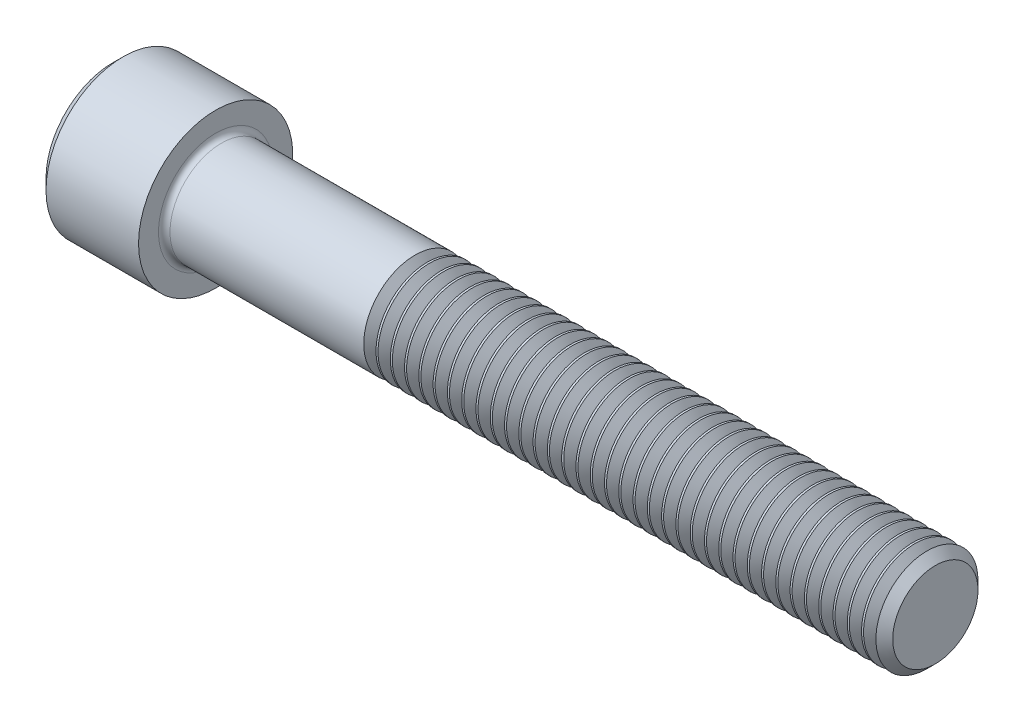
from build123d import *

# Parameters (mm, degrees)
SKETCH1_W             = 6.35
SKETCH1_H             = 4.7625
SKETCH2_R             = 3.175
BOSS_EXTRUDE1_DEPTH   = 12.321173718
SKETCH3_R             = 3.175
BOSS_EXTRUDE2_DEPTH   = 0.378826282
BOSS_EXTRUDE2_TAPER   = 55.000000002
SKETCH4_R             = 2.63398
BOSS_EXTRUDE3_DEPTH   = 0.378826282
BOSS_EXTRUDE3_DRAFT   = -55
SKETCH5_R             = 3.175
BOSS_EXTRUDE4_DEPTH   = 0.12429188
SKETCH6_R             = 3.175
BOSS_EXTRUDE5_DEPTH   = 0.378826282
BOSS_EXTRUDE5_TAPER   = 55.000000002
SKETCH7_R             = 2.63398
BOSS_EXTRUDE6_DEPTH   = 0.378826282
BOSS_EXTRUDE6_DRAFT   = -55
SKETCH8_R             = 3.175
BOSS_EXTRUDE7_DEPTH   = 0.12429188
SKETCH9_R             = 3.175
BOSS_EXTRUDE8_DEPTH   = 0.378826282
BOSS_EXTRUDE8_TAPER   = 55.000000002
SKETCH10_R            = 2.63398
BOSS_EXTRUDE9_DEPTH   = 0.378826282
BOSS_EXTRUDE9_DRAFT   = -55
SKETCH11_R            = 3.175
BOSS_EXTRUDE10_DEPTH  = 0.12429188
SKETCH12_R            = 3.175
BOSS_EXTRUDE11_DEPTH  = 0.378826282
BOSS_EXTRUDE11_TAPER  = 55.000000002
SKETCH13_R            = 2.63398
BOSS_EXTRUDE12_DEPTH  = 0.378826282
BOSS_EXTRUDE12_DRAFT  = -55
SKETCH14_R            = 3.175
BOSS_EXTRUDE13_DEPTH  = 0.12429188
SKETCH15_R            = 3.175
BOSS_EXTRUDE14_DEPTH  = 0.378826282
BOSS_EXTRUDE14_TAPER  = 55.000000002
SKETCH16_R            = 2.63398
BOSS_EXTRUDE15_DEPTH  = 0.378826282
BOSS_EXTRUDE15_DRAFT  = -55
SKETCH17_R            = 3.175
BOSS_EXTRUDE16_DEPTH  = 0.12429188
SKETCH18_R            = 3.175
BOSS_EXTRUDE17_DEPTH  = 0.378826282
BOSS_EXTRUDE17_TAPER  = 55.000000002
SKETCH19_R            = 2.63398
BOSS_EXTRUDE18_DEPTH  = 0.378826282
BOSS_EXTRUDE18_DRAFT  = -55
SKETCH20_R            = 3.175
BOSS_EXTRUDE19_DEPTH  = 0.12429188
SKETCH21_R            = 3.175
BOSS_EXTRUDE20_DEPTH  = 0.378826282
BOSS_EXTRUDE20_TAPER  = 55.000000002
SKETCH22_R            = 2.63398
BOSS_EXTRUDE21_DEPTH  = 0.378826282
BOSS_EXTRUDE21_DRAFT  = -55
SKETCH23_R            = 3.175
BOSS_EXTRUDE22_DEPTH  = 0.12429188
SKETCH24_R            = 3.175
BOSS_EXTRUDE23_DEPTH  = 0.378826282
BOSS_EXTRUDE23_TAPER  = 55.000000002
SKETCH25_R            = 2.63398
BOSS_EXTRUDE24_DEPTH  = 0.378826282
BOSS_EXTRUDE24_DRAFT  = -55
SKETCH26_R            = 3.175
BOSS_EXTRUDE25_DEPTH  = 0.12429188
SKETCH27_R            = 3.175
BOSS_EXTRUDE26_DEPTH  = 0.378826282
BOSS_EXTRUDE26_TAPER  = 55.000000002
SKETCH28_R            = 2.63398
BOSS_EXTRUDE27_DEPTH  = 0.378826282
BOSS_EXTRUDE27_DRAFT  = -55
SKETCH29_R            = 3.175
BOSS_EXTRUDE28_DEPTH  = 0.12429188
SKETCH30_R            = 3.175
BOSS_EXTRUDE29_DEPTH  = 0.378826282
BOSS_EXTRUDE29_TAPER  = 55.000000002
SKETCH31_R            = 2.63398
BOSS_EXTRUDE30_DEPTH  = 0.378826282
BOSS_EXTRUDE30_DRAFT  = -55
SKETCH32_R            = 3.175
BOSS_EXTRUDE31_DEPTH  = 0.12429188
SKETCH33_R            = 3.175
BOSS_EXTRUDE32_DEPTH  = 0.378826282
BOSS_EXTRUDE32_TAPER  = 55.000000002
SKETCH34_R            = 2.63398
BOSS_EXTRUDE33_DEPTH  = 0.378826282
BOSS_EXTRUDE33_DRAFT  = -55
SKETCH35_R            = 3.175
BOSS_EXTRUDE34_DEPTH  = 0.12429188
SKETCH36_R            = 3.175
BOSS_EXTRUDE35_DEPTH  = 0.378826282
BOSS_EXTRUDE35_TAPER  = 55.000000002
SKETCH37_R            = 2.63398
BOSS_EXTRUDE36_DEPTH  = 0.378826282
BOSS_EXTRUDE36_DRAFT  = -55
SKETCH38_R            = 3.175
BOSS_EXTRUDE37_DEPTH  = 0.12429188
SKETCH39_R            = 3.175
BOSS_EXTRUDE38_DEPTH  = 0.378826282
BOSS_EXTRUDE38_TAPER  = 55.000000002
SKETCH40_R            = 2.63398
BOSS_EXTRUDE39_DEPTH  = 0.378826282
BOSS_EXTRUDE39_DRAFT  = -55
SKETCH41_R            = 3.175
BOSS_EXTRUDE40_DEPTH  = 0.12429188
SKETCH42_R            = 3.175
BOSS_EXTRUDE41_DEPTH  = 0.378826282
BOSS_EXTRUDE41_TAPER  = 55.000000002
SKETCH43_R            = 2.63398
BOSS_EXTRUDE42_DEPTH  = 0.378826282
BOSS_EXTRUDE42_DRAFT  = -55
SKETCH44_R            = 3.175
BOSS_EXTRUDE43_DEPTH  = 0.12429188
SKETCH45_R            = 3.175
BOSS_EXTRUDE44_DEPTH  = 0.378826282
BOSS_EXTRUDE44_TAPER  = 54.999999999
SKETCH46_R            = 2.63398
BOSS_EXTRUDE45_DEPTH  = 0.378826282
BOSS_EXTRUDE45_DRAFT  = -55
SKETCH47_R            = 3.175
BOSS_EXTRUDE46_DEPTH  = 0.12429188
SKETCH48_R            = 3.175
BOSS_EXTRUDE47_DEPTH  = 0.378826282
BOSS_EXTRUDE47_TAPER  = 54.999999999
SKETCH49_R            = 2.63398
BOSS_EXTRUDE48_DEPTH  = 0.378826282
BOSS_EXTRUDE48_DRAFT  = -55
SKETCH50_R            = 3.175
BOSS_EXTRUDE49_DEPTH  = 0.12429188
SKETCH51_R            = 3.175
BOSS_EXTRUDE50_DEPTH  = 0.378826282
BOSS_EXTRUDE50_TAPER  = 54.999999999
SKETCH52_R            = 2.63398
BOSS_EXTRUDE51_DEPTH  = 0.378826282
BOSS_EXTRUDE51_DRAFT  = -55
SKETCH53_R            = 3.175
BOSS_EXTRUDE52_DEPTH  = 0.12429188
SKETCH54_R            = 3.175
BOSS_EXTRUDE53_DEPTH  = 0.378826282
BOSS_EXTRUDE53_TAPER  = 54.999999999
SKETCH55_R            = 2.63398
BOSS_EXTRUDE54_DEPTH  = 0.378826282
BOSS_EXTRUDE54_DRAFT  = -55
SKETCH56_R            = 3.175
BOSS_EXTRUDE55_DEPTH  = 0.12429188
SKETCH57_R            = 3.175
BOSS_EXTRUDE56_DEPTH  = 0.378826282
BOSS_EXTRUDE56_TAPER  = 54.999999999
SKETCH58_R            = 2.63398
BOSS_EXTRUDE57_DEPTH  = 0.378826282
BOSS_EXTRUDE57_DRAFT  = -55
SKETCH59_R            = 3.175
BOSS_EXTRUDE58_DEPTH  = 0.12429188
SKETCH60_R            = 3.175
BOSS_EXTRUDE59_DEPTH  = 0.378826282
BOSS_EXTRUDE59_TAPER  = 54.999999999
SKETCH61_R            = 2.63398
BOSS_EXTRUDE60_DEPTH  = 0.378826282
BOSS_EXTRUDE60_DRAFT  = -55
SKETCH62_R            = 3.175
BOSS_EXTRUDE61_DEPTH  = 0.12429188
SKETCH63_R            = 3.175
BOSS_EXTRUDE62_DEPTH  = 0.378826282
BOSS_EXTRUDE62_TAPER  = 54.999999999
SKETCH64_R            = 2.63398
BOSS_EXTRUDE63_DEPTH  = 0.378826282
BOSS_EXTRUDE63_DRAFT  = -55
SKETCH65_R            = 3.175
BOSS_EXTRUDE64_DEPTH  = 0.12429188
SKETCH66_R            = 3.175
BOSS_EXTRUDE65_DEPTH  = 0.378826282
BOSS_EXTRUDE65_TAPER  = 54.999999999
SKETCH67_R            = 2.63398
BOSS_EXTRUDE66_DEPTH  = 0.378826282
BOSS_EXTRUDE66_DRAFT  = -55
SKETCH68_R            = 3.175
BOSS_EXTRUDE67_DEPTH  = 0.12429188
SKETCH69_R            = 3.175
BOSS_EXTRUDE68_DEPTH  = 0.378826282
BOSS_EXTRUDE68_TAPER  = 54.999999999
SKETCH70_R            = 2.63398
BOSS_EXTRUDE69_DEPTH  = 0.378826282
BOSS_EXTRUDE69_DRAFT  = -55
SKETCH71_R            = 3.175
BOSS_EXTRUDE70_DEPTH  = 0.12429188
SKETCH72_R            = 3.175
BOSS_EXTRUDE71_DEPTH  = 0.378826282
BOSS_EXTRUDE71_TAPER  = 54.999999999
SKETCH73_R            = 2.63398
BOSS_EXTRUDE72_DEPTH  = 0.378826282
BOSS_EXTRUDE72_DRAFT  = -55
SKETCH74_R            = 3.175
BOSS_EXTRUDE73_DEPTH  = 0.12429188
SKETCH75_R            = 3.175
BOSS_EXTRUDE74_DEPTH  = 0.378826282
BOSS_EXTRUDE74_TAPER  = 54.999999999
SKETCH76_R            = 2.63398
BOSS_EXTRUDE75_DEPTH  = 0.378826282
BOSS_EXTRUDE75_DRAFT  = -55
SKETCH77_R            = 3.175
BOSS_EXTRUDE76_DEPTH  = 0.12429188
SKETCH78_R            = 3.175
BOSS_EXTRUDE77_DEPTH  = 0.378826282
BOSS_EXTRUDE77_TAPER  = 54.999999999
SKETCH79_R            = 2.63398
BOSS_EXTRUDE78_DEPTH  = 0.378826282
BOSS_EXTRUDE78_DRAFT  = -55
SKETCH80_R            = 3.175
BOSS_EXTRUDE79_DEPTH  = 0.12429188
SKETCH81_R            = 3.175
BOSS_EXTRUDE80_DEPTH  = 0.378826282
BOSS_EXTRUDE80_TAPER  = 54.999999999
SKETCH82_R            = 2.63398
BOSS_EXTRUDE81_DEPTH  = 0.378826282
BOSS_EXTRUDE81_DRAFT  = -55
SKETCH83_R            = 3.175
BOSS_EXTRUDE82_DEPTH  = 0.12429188
SKETCH84_R            = 3.175
BOSS_EXTRUDE83_DEPTH  = 0.378826282
BOSS_EXTRUDE83_TAPER  = 54.999999999
SKETCH85_R            = 2.63398
BOSS_EXTRUDE84_DEPTH  = 0.378826282
BOSS_EXTRUDE84_DRAFT  = -55
SKETCH86_R            = 3.175
BOSS_EXTRUDE85_DEPTH  = 0.12429188
SKETCH87_R            = 3.175
BOSS_EXTRUDE86_DEPTH  = 0.378826282
BOSS_EXTRUDE86_TAPER  = 54.999999999
SKETCH88_R            = 2.63398
BOSS_EXTRUDE87_DEPTH  = 0.378826282
BOSS_EXTRUDE87_DRAFT  = -55
SKETCH89_R            = 3.175
BOSS_EXTRUDE88_DEPTH  = 0.12429188
SKETCH90_R            = 3.175
BOSS_EXTRUDE89_DEPTH  = 0.378826282
BOSS_EXTRUDE89_TAPER  = 54.999999999
SKETCH91_R            = 2.63398
BOSS_EXTRUDE90_DEPTH  = 0.378826282
BOSS_EXTRUDE90_DRAFT  = -55
SKETCH92_R            = 3.175
BOSS_EXTRUDE91_DEPTH  = 0.12429188
SKETCH93_R            = 3.175
BOSS_EXTRUDE92_DEPTH  = 0.378826282
BOSS_EXTRUDE92_TAPER  = 54.999999999
SKETCH94_R            = 2.63398
BOSS_EXTRUDE93_DEPTH  = 0.378826282
BOSS_EXTRUDE93_DRAFT  = -55
SKETCH95_R            = 3.175
BOSS_EXTRUDE94_DEPTH  = 0.12429188
SKETCH96_R            = 3.175
BOSS_EXTRUDE95_DEPTH  = 0.378826282
BOSS_EXTRUDE95_TAPER  = 54.999999999
SKETCH97_R            = 2.63398
BOSS_EXTRUDE96_DEPTH  = 0.378826282
BOSS_EXTRUDE96_DRAFT  = -55
SKETCH98_R            = 3.175
BOSS_EXTRUDE97_DEPTH  = 0.12429188
SKETCH99_R            = 3.175
BOSS_EXTRUDE98_DEPTH  = 0.378826282
BOSS_EXTRUDE98_TAPER  = 54.999999999
SKETCH100_R           = 2.63398
BOSS_EXTRUDE99_DEPTH  = 0.378826282
BOSS_EXTRUDE99_DRAFT  = -55
SKETCH101_R           = 3.175
BOSS_EXTRUDE100_DEPTH = 0.12429188
SKETCH102_R           = 3.175
BOSS_EXTRUDE101_DEPTH = 0.378826282
BOSS_EXTRUDE101_TAPER = 54.999999999
SKETCH103_R           = 2.63398
BOSS_EXTRUDE102_DEPTH = 0.378826282
BOSS_EXTRUDE102_DRAFT = -55
SKETCH104_R           = 3.175
BOSS_EXTRUDE103_DEPTH = 0.12429188
SKETCH105_R           = 3.175
BOSS_EXTRUDE104_DEPTH = 0.378826282
BOSS_EXTRUDE104_TAPER = 54.999999999
SKETCH106_R           = 2.63398
BOSS_EXTRUDE105_DEPTH = 0.378826282
BOSS_EXTRUDE105_DRAFT = -55
SKETCH107_R           = 3.175
BOSS_EXTRUDE106_DEPTH = 0.12429188
SKETCH108_R           = 3.175
BOSS_EXTRUDE107_DEPTH = 0.378826282
BOSS_EXTRUDE107_TAPER = 54.999999999
SKETCH109_R           = 2.63398
BOSS_EXTRUDE108_DEPTH = 0.363216922
BOSS_EXTRUDE108_DRAFT = -54.999999998
SKETCH110_R           = 3.152707523
BOSS_EXTRUDE109_DEPTH = 0.518727523
BOSS_EXTRUDE109_TAPER = 45
CUT_EXTRUDE1_DEPTH    = 3.048
CHAMFER1_SIZE         = 0.635
FILLET1_R             = 0.3556


with BuildPart() as part:
    # Sketch1 → Revolve1 (revolve)
    with BuildSketch(Plane(origin=(0, 0, 0), x_dir=(-1, 0, 0), z_dir=(0, 0, -1)), mode=Mode.PRIVATE) as revolve1_sk:
        with Locations((-3.175, 2.38125)):
            Rectangle(SKETCH1_W, SKETCH1_H)
    revolve(revolve1_sk.sketch.rotate(Axis((6.35, 0, 0), (-1, 0, 0)), 270), axis=Axis((6.35, 0, 0), (-1, 0, 0)))

    # Sketch2 → Boss-Extrude1 (add)
    with BuildSketch(Plane(origin=(6.35, 0, 0), x_dir=(0, 0, -1), z_dir=(1, 0, 0))):
        Circle(SKETCH2_R)
    extrude(amount=BOSS_EXTRUDE1_DEPTH)

    # Sketch3 → Boss-Extrude2 (add)
    with BuildSketch(Plane(origin=(18.671173718, 0, 0), x_dir=(0, 0, -1), z_dir=(1, 0, 0))):
        Circle(SKETCH3_R)
    extrude(amount=BOSS_EXTRUDE2_DEPTH, taper=BOSS_EXTRUDE2_TAPER)


with BuildPart() as boss_extrude3_tool:
    # Sketch4 → Boss-Extrude3 (with draft: the straight prism first)
    with BuildSketch(Plane(origin=(19.05, 0, 0), x_dir=(0, 0, -1), z_dir=(1, 0, 0))):
        Circle(SKETCH4_R)
    extrude(amount=BOSS_EXTRUDE3_DEPTH)
    # Boss-Extrude3: the draft: its side faces are tilted about the plane it starts from
    boss_extrude3_sides = [boss_extrude3_tool.faces().sort_by_distance(p)[0] for p in [
        (19.239413141, 0, 2.63398),
    ]]
    draft(boss_extrude3_sides, Plane(origin=(19.05, 0, 0), x_dir=(0, 0, -1), z_dir=(1, 0, 0)), BOSS_EXTRUDE3_DRAFT)


with BuildPart() as part_1:
    add(part.part)

    # Boss-Extrude3: add boss_extrude3_tool
    add(boss_extrude3_tool.part)

    # Sketch5 → Boss-Extrude4 (add)
    with BuildSketch(Plane(origin=(19.428826282, 0, 0), x_dir=(0, 0, -1), z_dir=(1, 0, 0))):
        Circle(SKETCH5_R)
    extrude(amount=BOSS_EXTRUDE4_DEPTH)

    # Sketch6 → Boss-Extrude5 (add)
    with BuildSketch(Plane(origin=(19.553118162, 0, 0), x_dir=(0, 0, -1), z_dir=(1, 0, 0))):
        Circle(SKETCH6_R)
    extrude(amount=BOSS_EXTRUDE5_DEPTH, taper=BOSS_EXTRUDE5_TAPER)


with BuildPart() as boss_extrude6_tool:
    # Sketch7 → Boss-Extrude6 (with draft: the straight prism first)
    with BuildSketch(Plane(origin=(19.931944444, 0, 0), x_dir=(0, 0, -1), z_dir=(1, 0, 0))):
        Circle(SKETCH7_R)
    extrude(amount=BOSS_EXTRUDE6_DEPTH)
    # Boss-Extrude6: the draft: its side faces are tilted about the plane it starts from
    boss_extrude6_sides = [boss_extrude6_tool.faces().sort_by_distance(p)[0] for p in [
        (20.121357586, 0, 2.63398),
    ]]
    draft(boss_extrude6_sides, Plane(origin=(19.931944444, 0, 0), x_dir=(0, 0, -1), z_dir=(1, 0, 0)), BOSS_EXTRUDE6_DRAFT)


with BuildPart() as part_2:
    add(part_1.part)

    # Boss-Extrude6: add boss_extrude6_tool
    add(boss_extrude6_tool.part)

    # Sketch8 → Boss-Extrude7 (add)
    with BuildSketch(Plane(origin=(20.310770727, 0, 0), x_dir=(0, 0, -1), z_dir=(1, 0, 0))):
        Circle(SKETCH8_R)
    extrude(amount=BOSS_EXTRUDE7_DEPTH)

    # Sketch9 → Boss-Extrude8 (add)
    with BuildSketch(Plane(origin=(20.435062607, 0, 0), x_dir=(0, 0, -1), z_dir=(1, 0, 0))):
        Circle(SKETCH9_R)
    extrude(amount=BOSS_EXTRUDE8_DEPTH, taper=BOSS_EXTRUDE8_TAPER)


with BuildPart() as boss_extrude9_tool:
    # Sketch10 → Boss-Extrude9 (with draft: the straight prism first)
    with BuildSketch(Plane(origin=(20.813888889, 0, 0), x_dir=(0, 0, -1), z_dir=(1, 0, 0))):
        Circle(SKETCH10_R)
    extrude(amount=BOSS_EXTRUDE9_DEPTH)
    # Boss-Extrude9: the draft: its side faces are tilted about the plane it starts from
    boss_extrude9_sides = [boss_extrude9_tool.faces().sort_by_distance(p)[0] for p in [
        (21.00330203, 0, 2.63398),
    ]]
    draft(boss_extrude9_sides, Plane(origin=(20.813888889, 0, 0), x_dir=(0, 0, -1), z_dir=(1, 0, 0)), BOSS_EXTRUDE9_DRAFT)


with BuildPart() as part_3:
    add(part_2.part)

    # Boss-Extrude9: add boss_extrude9_tool
    add(boss_extrude9_tool.part)

    # Sketch11 → Boss-Extrude10 (add)
    with BuildSketch(Plane(origin=(21.192715171, 0, 0), x_dir=(0, 0, -1), z_dir=(1, 0, 0))):
        Circle(SKETCH11_R)
    extrude(amount=BOSS_EXTRUDE10_DEPTH)

    # Sketch12 → Boss-Extrude11 (add)
    with BuildSketch(Plane(origin=(21.317007051, 0, 0), x_dir=(0, 0, -1), z_dir=(1, 0, 0))):
        Circle(SKETCH12_R)
    extrude(amount=BOSS_EXTRUDE11_DEPTH, taper=BOSS_EXTRUDE11_TAPER)


with BuildPart() as boss_extrude12_tool:
    # Sketch13 → Boss-Extrude12 (with draft: the straight prism first)
    with BuildSketch(Plane(origin=(21.695833333, 0, 0), x_dir=(0, 0, -1), z_dir=(1, 0, 0))):
        Circle(SKETCH13_R)
    extrude(amount=BOSS_EXTRUDE12_DEPTH)
    # Boss-Extrude12: the draft: its side faces are tilted about the plane it starts from
    boss_extrude12_sides = [boss_extrude12_tool.faces().sort_by_distance(p)[0] for p in [
        (21.885246475, 0, 2.63398),
    ]]
    draft(boss_extrude12_sides, Plane(origin=(21.695833333, 0, 0), x_dir=(0, 0, -1), z_dir=(1, 0, 0)), BOSS_EXTRUDE12_DRAFT)


with BuildPart() as part_4:
    add(part_3.part)

    # Boss-Extrude12: add boss_extrude12_tool
    add(boss_extrude12_tool.part)

    # Sketch14 → Boss-Extrude13 (add)
    with BuildSketch(Plane(origin=(22.074659616, 0, 0), x_dir=(0, 0, -1), z_dir=(1, 0, 0))):
        Circle(SKETCH14_R)
    extrude(amount=BOSS_EXTRUDE13_DEPTH)

    # Sketch15 → Boss-Extrude14 (add)
    with BuildSketch(Plane(origin=(22.198951495, 0, 0), x_dir=(0, 0, -1), z_dir=(1, 0, 0))):
        Circle(SKETCH15_R)
    extrude(amount=BOSS_EXTRUDE14_DEPTH, taper=BOSS_EXTRUDE14_TAPER)


with BuildPart() as boss_extrude15_tool:
    # Sketch16 → Boss-Extrude15 (with draft: the straight prism first)
    with BuildSketch(Plane(origin=(22.577777778, 0, 0), x_dir=(0, 0, -1), z_dir=(1, 0, 0))):
        Circle(SKETCH16_R)
    extrude(amount=BOSS_EXTRUDE15_DEPTH)
    # Boss-Extrude15: the draft: its side faces are tilted about the plane it starts from
    boss_extrude15_sides = [boss_extrude15_tool.faces().sort_by_distance(p)[0] for p in [
        (22.767190919, 0, 2.63398),
    ]]
    draft(boss_extrude15_sides, Plane(origin=(22.577777778, 0, 0), x_dir=(0, 0, -1), z_dir=(1, 0, 0)), BOSS_EXTRUDE15_DRAFT)


with BuildPart() as part_5:
    add(part_4.part)

    # Boss-Extrude15: add boss_extrude15_tool
    add(boss_extrude15_tool.part)

    # Sketch17 → Boss-Extrude16 (add)
    with BuildSketch(Plane(origin=(22.95660406, 0, 0), x_dir=(0, 0, -1), z_dir=(1, 0, 0))):
        Circle(SKETCH17_R)
    extrude(amount=BOSS_EXTRUDE16_DEPTH)

    # Sketch18 → Boss-Extrude17 (add)
    with BuildSketch(Plane(origin=(23.08089594, 0, 0), x_dir=(0, 0, -1), z_dir=(1, 0, 0))):
        Circle(SKETCH18_R)
    extrude(amount=BOSS_EXTRUDE17_DEPTH, taper=BOSS_EXTRUDE17_TAPER)


with BuildPart() as boss_extrude18_tool:
    # Sketch19 → Boss-Extrude18 (with draft: the straight prism first)
    with BuildSketch(Plane(origin=(23.459722222, 0, 0), x_dir=(0, 0, -1), z_dir=(1, 0, 0))):
        Circle(SKETCH19_R)
    extrude(amount=BOSS_EXTRUDE18_DEPTH)
    # Boss-Extrude18: the draft: its side faces are tilted about the plane it starts from
    boss_extrude18_sides = [boss_extrude18_tool.faces().sort_by_distance(p)[0] for p in [
        (23.649135363, 0, 2.63398),
    ]]
    draft(boss_extrude18_sides, Plane(origin=(23.459722222, 0, 0), x_dir=(0, 0, -1), z_dir=(1, 0, 0)), BOSS_EXTRUDE18_DRAFT)


with BuildPart() as part_6:
    add(part_5.part)

    # Boss-Extrude18: add boss_extrude18_tool
    add(boss_extrude18_tool.part)

    # Sketch20 → Boss-Extrude19 (add)
    with BuildSketch(Plane(origin=(23.838548505, 0, 0), x_dir=(0, 0, -1), z_dir=(1, 0, 0))):
        Circle(SKETCH20_R)
    extrude(amount=BOSS_EXTRUDE19_DEPTH)

    # Sketch21 → Boss-Extrude20 (add)
    with BuildSketch(Plane(origin=(23.962840384, 0, 0), x_dir=(0, 0, -1), z_dir=(1, 0, 0))):
        Circle(SKETCH21_R)
    extrude(amount=BOSS_EXTRUDE20_DEPTH, taper=BOSS_EXTRUDE20_TAPER)


with BuildPart() as boss_extrude21_tool:
    # Sketch22 → Boss-Extrude21 (with draft: the straight prism first)
    with BuildSketch(Plane(origin=(24.341666667, 0, 0), x_dir=(0, 0, -1), z_dir=(1, 0, 0))):
        Circle(SKETCH22_R)
    extrude(amount=BOSS_EXTRUDE21_DEPTH)
    # Boss-Extrude21: the draft: its side faces are tilted about the plane it starts from
    boss_extrude21_sides = [boss_extrude21_tool.faces().sort_by_distance(p)[0] for p in [
        (24.531079808, 0, 2.63398),
    ]]
    draft(boss_extrude21_sides, Plane(origin=(24.341666667, 0, 0), x_dir=(0, 0, -1), z_dir=(1, 0, 0)), BOSS_EXTRUDE21_DRAFT)


with BuildPart() as part_7:
    add(part_6.part)

    # Boss-Extrude21: add boss_extrude21_tool
    add(boss_extrude21_tool.part)

    # Sketch23 → Boss-Extrude22 (add)
    with BuildSketch(Plane(origin=(24.720492949, 0, 0), x_dir=(0, 0, -1), z_dir=(1, 0, 0))):
        Circle(SKETCH23_R)
    extrude(amount=BOSS_EXTRUDE22_DEPTH)

    # Sketch24 → Boss-Extrude23 (add)
    with BuildSketch(Plane(origin=(24.844784829, 0, 0), x_dir=(0, 0, -1), z_dir=(1, 0, 0))):
        Circle(SKETCH24_R)
    extrude(amount=BOSS_EXTRUDE23_DEPTH, taper=BOSS_EXTRUDE23_TAPER)


with BuildPart() as boss_extrude24_tool:
    # Sketch25 → Boss-Extrude24 (with draft: the straight prism first)
    with BuildSketch(Plane(origin=(25.223611111, 0, 0), x_dir=(0, 0, -1), z_dir=(1, 0, 0))):
        Circle(SKETCH25_R)
    extrude(amount=BOSS_EXTRUDE24_DEPTH)
    # Boss-Extrude24: the draft: its side faces are tilted about the plane it starts from
    boss_extrude24_sides = [boss_extrude24_tool.faces().sort_by_distance(p)[0] for p in [
        (25.413024252, 0, 2.63398),
    ]]
    draft(boss_extrude24_sides, Plane(origin=(25.223611111, 0, 0), x_dir=(0, 0, -1), z_dir=(1, 0, 0)), BOSS_EXTRUDE24_DRAFT)


with BuildPart() as part_8:
    add(part_7.part)

    # Boss-Extrude24: add boss_extrude24_tool
    add(boss_extrude24_tool.part)

    # Sketch26 → Boss-Extrude25 (add)
    with BuildSketch(Plane(origin=(25.602437394, 0, 0), x_dir=(0, 0, -1), z_dir=(1, 0, 0))):
        Circle(SKETCH26_R)
    extrude(amount=BOSS_EXTRUDE25_DEPTH)

    # Sketch27 → Boss-Extrude26 (add)
    with BuildSketch(Plane(origin=(25.726729273, 0, 0), x_dir=(0, 0, -1), z_dir=(1, 0, 0))):
        Circle(SKETCH27_R)
    extrude(amount=BOSS_EXTRUDE26_DEPTH, taper=BOSS_EXTRUDE26_TAPER)


with BuildPart() as boss_extrude27_tool:
    # Sketch28 → Boss-Extrude27 (with draft: the straight prism first)
    with BuildSketch(Plane(origin=(26.105555556, 0, 0), x_dir=(0, 0, -1), z_dir=(1, 0, 0))):
        Circle(SKETCH28_R)
    extrude(amount=BOSS_EXTRUDE27_DEPTH)
    # Boss-Extrude27: the draft: its side faces are tilted about the plane it starts from
    boss_extrude27_sides = [boss_extrude27_tool.faces().sort_by_distance(p)[0] for p in [
        (26.294968697, 0, 2.63398),
    ]]
    draft(boss_extrude27_sides, Plane(origin=(26.105555556, 0, 0), x_dir=(0, 0, -1), z_dir=(1, 0, 0)), BOSS_EXTRUDE27_DRAFT)


with BuildPart() as part_9:
    add(part_8.part)

    # Boss-Extrude27: add boss_extrude27_tool
    add(boss_extrude27_tool.part)

    # Sketch29 → Boss-Extrude28 (add)
    with BuildSketch(Plane(origin=(26.484381838, 0, 0), x_dir=(0, 0, -1), z_dir=(1, 0, 0))):
        Circle(SKETCH29_R)
    extrude(amount=BOSS_EXTRUDE28_DEPTH)

    # Sketch30 → Boss-Extrude29 (add)
    with BuildSketch(Plane(origin=(26.608673718, 0, 0), x_dir=(0, 0, -1), z_dir=(1, 0, 0))):
        Circle(SKETCH30_R)
    extrude(amount=BOSS_EXTRUDE29_DEPTH, taper=BOSS_EXTRUDE29_TAPER)


with BuildPart() as boss_extrude30_tool:
    # Sketch31 → Boss-Extrude30 (with draft: the straight prism first)
    with BuildSketch(Plane(origin=(26.9875, 0, 0), x_dir=(0, 0, -1), z_dir=(1, 0, 0))):
        Circle(SKETCH31_R)
    extrude(amount=BOSS_EXTRUDE30_DEPTH)
    # Boss-Extrude30: the draft: its side faces are tilted about the plane it starts from
    boss_extrude30_sides = [boss_extrude30_tool.faces().sort_by_distance(p)[0] for p in [
        (27.176913141, 0, 2.63398),
    ]]
    draft(boss_extrude30_sides, Plane(origin=(26.9875, 0, 0), x_dir=(0, 0, -1), z_dir=(1, 0, 0)), BOSS_EXTRUDE30_DRAFT)


with BuildPart() as part_10:
    add(part_9.part)

    # Boss-Extrude30: add boss_extrude30_tool
    add(boss_extrude30_tool.part)

    # Sketch32 → Boss-Extrude31 (add)
    with BuildSketch(Plane(origin=(27.366326282, 0, 0), x_dir=(0, 0, -1), z_dir=(1, 0, 0))):
        Circle(SKETCH32_R)
    extrude(amount=BOSS_EXTRUDE31_DEPTH)

    # Sketch33 → Boss-Extrude32 (add)
    with BuildSketch(Plane(origin=(27.490618162, 0, 0), x_dir=(0, 0, -1), z_dir=(1, 0, 0))):
        Circle(SKETCH33_R)
    extrude(amount=BOSS_EXTRUDE32_DEPTH, taper=BOSS_EXTRUDE32_TAPER)


with BuildPart() as boss_extrude33_tool:
    # Sketch34 → Boss-Extrude33 (with draft: the straight prism first)
    with BuildSketch(Plane(origin=(27.869444444, 0, 0), x_dir=(0, 0, -1), z_dir=(1, 0, 0))):
        Circle(SKETCH34_R)
    extrude(amount=BOSS_EXTRUDE33_DEPTH)
    # Boss-Extrude33: the draft: its side faces are tilted about the plane it starts from
    boss_extrude33_sides = [boss_extrude33_tool.faces().sort_by_distance(p)[0] for p in [
        (28.058857586, 0, 2.63398),
    ]]
    draft(boss_extrude33_sides, Plane(origin=(27.869444444, 0, 0), x_dir=(0, 0, -1), z_dir=(1, 0, 0)), BOSS_EXTRUDE33_DRAFT)


with BuildPart() as part_11:
    add(part_10.part)

    # Boss-Extrude33: add boss_extrude33_tool
    add(boss_extrude33_tool.part)

    # Sketch35 → Boss-Extrude34 (add)
    with BuildSketch(Plane(origin=(28.248270727, 0, 0), x_dir=(0, 0, -1), z_dir=(1, 0, 0))):
        Circle(SKETCH35_R)
    extrude(amount=BOSS_EXTRUDE34_DEPTH)

    # Sketch36 → Boss-Extrude35 (add)
    with BuildSketch(Plane(origin=(28.372562607, 0, 0), x_dir=(0, 0, -1), z_dir=(1, 0, 0))):
        Circle(SKETCH36_R)
    extrude(amount=BOSS_EXTRUDE35_DEPTH, taper=BOSS_EXTRUDE35_TAPER)


with BuildPart() as boss_extrude36_tool:
    # Sketch37 → Boss-Extrude36 (with draft: the straight prism first)
    with BuildSketch(Plane(origin=(28.751388889, 0, 0), x_dir=(0, 0, -1), z_dir=(1, 0, 0))):
        Circle(SKETCH37_R)
    extrude(amount=BOSS_EXTRUDE36_DEPTH)
    # Boss-Extrude36: the draft: its side faces are tilted about the plane it starts from
    boss_extrude36_sides = [boss_extrude36_tool.faces().sort_by_distance(p)[0] for p in [
        (28.94080203, 0, 2.63398),
    ]]
    draft(boss_extrude36_sides, Plane(origin=(28.751388889, 0, 0), x_dir=(0, 0, -1), z_dir=(1, 0, 0)), BOSS_EXTRUDE36_DRAFT)


with BuildPart() as part_12:
    add(part_11.part)

    # Boss-Extrude36: add boss_extrude36_tool
    add(boss_extrude36_tool.part)

    # Sketch38 → Boss-Extrude37 (add)
    with BuildSketch(Plane(origin=(29.130215171, 0, 0), x_dir=(0, 0, -1), z_dir=(1, 0, 0))):
        Circle(SKETCH38_R)
    extrude(amount=BOSS_EXTRUDE37_DEPTH)

    # Sketch39 → Boss-Extrude38 (add)
    with BuildSketch(Plane(origin=(29.254507051, 0, 0), x_dir=(0, 0, -1), z_dir=(1, 0, 0))):
        Circle(SKETCH39_R)
    extrude(amount=BOSS_EXTRUDE38_DEPTH, taper=BOSS_EXTRUDE38_TAPER)


with BuildPart() as boss_extrude39_tool:
    # Sketch40 → Boss-Extrude39 (with draft: the straight prism first)
    with BuildSketch(Plane(origin=(29.633333333, 0, 0), x_dir=(0, 0, -1), z_dir=(1, 0, 0))):
        Circle(SKETCH40_R)
    extrude(amount=BOSS_EXTRUDE39_DEPTH)
    # Boss-Extrude39: the draft: its side faces are tilted about the plane it starts from
    boss_extrude39_sides = [boss_extrude39_tool.faces().sort_by_distance(p)[0] for p in [
        (29.822746475, 0, 2.63398),
    ]]
    draft(boss_extrude39_sides, Plane(origin=(29.633333333, 0, 0), x_dir=(0, 0, -1), z_dir=(1, 0, 0)), BOSS_EXTRUDE39_DRAFT)


with BuildPart() as part_13:
    add(part_12.part)

    # Boss-Extrude39: add boss_extrude39_tool
    add(boss_extrude39_tool.part)

    # Sketch41 → Boss-Extrude40 (add)
    with BuildSketch(Plane(origin=(30.012159616, 0, 0), x_dir=(0, 0, -1), z_dir=(1, 0, 0))):
        Circle(SKETCH41_R)
    extrude(amount=BOSS_EXTRUDE40_DEPTH)

    # Sketch42 → Boss-Extrude41 (add)
    with BuildSketch(Plane(origin=(30.136451495, 0, 0), x_dir=(0, 0, -1), z_dir=(1, 0, 0))):
        Circle(SKETCH42_R)
    extrude(amount=BOSS_EXTRUDE41_DEPTH, taper=BOSS_EXTRUDE41_TAPER)


with BuildPart() as boss_extrude42_tool:
    # Sketch43 → Boss-Extrude42 (with draft: the straight prism first)
    with BuildSketch(Plane(origin=(30.515277778, 0, 0), x_dir=(0, 0, -1), z_dir=(1, 0, 0))):
        Circle(SKETCH43_R)
    extrude(amount=BOSS_EXTRUDE42_DEPTH)
    # Boss-Extrude42: the draft: its side faces are tilted about the plane it starts from
    boss_extrude42_sides = [boss_extrude42_tool.faces().sort_by_distance(p)[0] for p in [
        (30.704690919, 0, 2.63398),
    ]]
    draft(boss_extrude42_sides, Plane(origin=(30.515277778, 0, 0), x_dir=(0, 0, -1), z_dir=(1, 0, 0)), BOSS_EXTRUDE42_DRAFT)


with BuildPart() as part_14:
    add(part_13.part)

    # Boss-Extrude42: add boss_extrude42_tool
    add(boss_extrude42_tool.part)

    # Sketch44 → Boss-Extrude43 (add)
    with BuildSketch(Plane(origin=(30.89410406, 0, 0), x_dir=(0, 0, -1), z_dir=(1, 0, 0))):
        Circle(SKETCH44_R)
    extrude(amount=BOSS_EXTRUDE43_DEPTH)

    # Sketch45 → Boss-Extrude44 (add)
    with BuildSketch(Plane(origin=(31.01839594, 0, 0), x_dir=(0, 0, -1), z_dir=(1, 0, 0))):
        Circle(SKETCH45_R)
    extrude(amount=BOSS_EXTRUDE44_DEPTH, taper=BOSS_EXTRUDE44_TAPER)


with BuildPart() as boss_extrude45_tool:
    # Sketch46 → Boss-Extrude45 (with draft: the straight prism first)
    with BuildSketch(Plane(origin=(31.397222222, 0, 0), x_dir=(0, 0, -1), z_dir=(1, 0, 0))):
        Circle(SKETCH46_R)
    extrude(amount=BOSS_EXTRUDE45_DEPTH)
    # Boss-Extrude45: the draft: its side faces are tilted about the plane it starts from
    boss_extrude45_sides = [boss_extrude45_tool.faces().sort_by_distance(p)[0] for p in [
        (31.586635363, 0, 2.63398),
    ]]
    draft(boss_extrude45_sides, Plane(origin=(31.397222222, 0, 0), x_dir=(0, 0, -1), z_dir=(1, 0, 0)), BOSS_EXTRUDE45_DRAFT)


with BuildPart() as part_15:
    add(part_14.part)

    # Boss-Extrude45: add boss_extrude45_tool
    add(boss_extrude45_tool.part)

    # Sketch47 → Boss-Extrude46 (add)
    with BuildSketch(Plane(origin=(31.776048505, 0, 0), x_dir=(0, 0, -1), z_dir=(1, 0, 0))):
        Circle(SKETCH47_R)
    extrude(amount=BOSS_EXTRUDE46_DEPTH)

    # Sketch48 → Boss-Extrude47 (add)
    with BuildSketch(Plane(origin=(31.900340384, 0, 0), x_dir=(0, 0, -1), z_dir=(1, 0, 0))):
        Circle(SKETCH48_R)
    extrude(amount=BOSS_EXTRUDE47_DEPTH, taper=BOSS_EXTRUDE47_TAPER)


with BuildPart() as boss_extrude48_tool:
    # Sketch49 → Boss-Extrude48 (with draft: the straight prism first)
    with BuildSketch(Plane(origin=(32.279166667, 0, 0), x_dir=(0, 0, -1), z_dir=(1, 0, 0))):
        Circle(SKETCH49_R)
    extrude(amount=BOSS_EXTRUDE48_DEPTH)
    # Boss-Extrude48: the draft: its side faces are tilted about the plane it starts from
    boss_extrude48_sides = [boss_extrude48_tool.faces().sort_by_distance(p)[0] for p in [
        (32.468579808, 0, 2.63398),
    ]]
    draft(boss_extrude48_sides, Plane(origin=(32.279166667, 0, 0), x_dir=(0, 0, -1), z_dir=(1, 0, 0)), BOSS_EXTRUDE48_DRAFT)


with BuildPart() as part_16:
    add(part_15.part)

    # Boss-Extrude48: add boss_extrude48_tool
    add(boss_extrude48_tool.part)

    # Sketch50 → Boss-Extrude49 (add)
    with BuildSketch(Plane(origin=(32.657992949, 0, 0), x_dir=(0, 0, -1), z_dir=(1, 0, 0))):
        Circle(SKETCH50_R)
    extrude(amount=BOSS_EXTRUDE49_DEPTH)

    # Sketch51 → Boss-Extrude50 (add)
    with BuildSketch(Plane(origin=(32.782284829, 0, 0), x_dir=(0, 0, -1), z_dir=(1, 0, 0))):
        Circle(SKETCH51_R)
    extrude(amount=BOSS_EXTRUDE50_DEPTH, taper=BOSS_EXTRUDE50_TAPER)


with BuildPart() as boss_extrude51_tool:
    # Sketch52 → Boss-Extrude51 (with draft: the straight prism first)
    with BuildSketch(Plane(origin=(33.161111111, 0, 0), x_dir=(0, 0, -1), z_dir=(1, 0, 0))):
        Circle(SKETCH52_R)
    extrude(amount=BOSS_EXTRUDE51_DEPTH)
    # Boss-Extrude51: the draft: its side faces are tilted about the plane it starts from
    boss_extrude51_sides = [boss_extrude51_tool.faces().sort_by_distance(p)[0] for p in [
        (33.350524252, 0, 2.63398),
    ]]
    draft(boss_extrude51_sides, Plane(origin=(33.161111111, 0, 0), x_dir=(0, 0, -1), z_dir=(1, 0, 0)), BOSS_EXTRUDE51_DRAFT)


with BuildPart() as part_17:
    add(part_16.part)

    # Boss-Extrude51: add boss_extrude51_tool
    add(boss_extrude51_tool.part)

    # Sketch53 → Boss-Extrude52 (add)
    with BuildSketch(Plane(origin=(33.539937393, 0, 0), x_dir=(0, 0, -1), z_dir=(1, 0, 0))):
        Circle(SKETCH53_R)
    extrude(amount=BOSS_EXTRUDE52_DEPTH)

    # Sketch54 → Boss-Extrude53 (add)
    with BuildSketch(Plane(origin=(33.664229273, 0, 0), x_dir=(0, 0, -1), z_dir=(1, 0, 0))):
        Circle(SKETCH54_R)
    extrude(amount=BOSS_EXTRUDE53_DEPTH, taper=BOSS_EXTRUDE53_TAPER)


with BuildPart() as boss_extrude54_tool:
    # Sketch55 → Boss-Extrude54 (with draft: the straight prism first)
    with BuildSketch(Plane(origin=(34.043055556, 0, 0), x_dir=(0, 0, -1), z_dir=(1, 0, 0))):
        Circle(SKETCH55_R)
    extrude(amount=BOSS_EXTRUDE54_DEPTH)
    # Boss-Extrude54: the draft: its side faces are tilted about the plane it starts from
    boss_extrude54_sides = [boss_extrude54_tool.faces().sort_by_distance(p)[0] for p in [
        (34.232468697, 0, 2.63398),
    ]]
    draft(boss_extrude54_sides, Plane(origin=(34.043055556, 0, 0), x_dir=(0, 0, -1), z_dir=(1, 0, 0)), BOSS_EXTRUDE54_DRAFT)


with BuildPart() as part_18:
    add(part_17.part)

    # Boss-Extrude54: add boss_extrude54_tool
    add(boss_extrude54_tool.part)

    # Sketch56 → Boss-Extrude55 (add)
    with BuildSketch(Plane(origin=(34.421881838, 0, 0), x_dir=(0, 0, -1), z_dir=(1, 0, 0))):
        Circle(SKETCH56_R)
    extrude(amount=BOSS_EXTRUDE55_DEPTH)

    # Sketch57 → Boss-Extrude56 (add)
    with BuildSketch(Plane(origin=(34.546173718, 0, 0), x_dir=(0, 0, -1), z_dir=(1, 0, 0))):
        Circle(SKETCH57_R)
    extrude(amount=BOSS_EXTRUDE56_DEPTH, taper=BOSS_EXTRUDE56_TAPER)


with BuildPart() as boss_extrude57_tool:
    # Sketch58 → Boss-Extrude57 (with draft: the straight prism first)
    with BuildSketch(Plane(origin=(34.925, 0, 0), x_dir=(0, 0, -1), z_dir=(1, 0, 0))):
        Circle(SKETCH58_R)
    extrude(amount=BOSS_EXTRUDE57_DEPTH)
    # Boss-Extrude57: the draft: its side faces are tilted about the plane it starts from
    boss_extrude57_sides = [boss_extrude57_tool.faces().sort_by_distance(p)[0] for p in [
        (35.114413141, 0, 2.63398),
    ]]
    draft(boss_extrude57_sides, Plane(origin=(34.925, 0, 0), x_dir=(0, 0, -1), z_dir=(1, 0, 0)), BOSS_EXTRUDE57_DRAFT)


with BuildPart() as part_19:
    add(part_18.part)

    # Boss-Extrude57: add boss_extrude57_tool
    add(boss_extrude57_tool.part)

    # Sketch59 → Boss-Extrude58 (add)
    with BuildSketch(Plane(origin=(35.303826282, 0, 0), x_dir=(0, 0, -1), z_dir=(1, 0, 0))):
        Circle(SKETCH59_R)
    extrude(amount=BOSS_EXTRUDE58_DEPTH)

    # Sketch60 → Boss-Extrude59 (add)
    with BuildSketch(Plane(origin=(35.428118162, 0, 0), x_dir=(0, 0, -1), z_dir=(1, 0, 0))):
        Circle(SKETCH60_R)
    extrude(amount=BOSS_EXTRUDE59_DEPTH, taper=BOSS_EXTRUDE59_TAPER)


with BuildPart() as boss_extrude60_tool:
    # Sketch61 → Boss-Extrude60 (with draft: the straight prism first)
    with BuildSketch(Plane(origin=(35.806944444, 0, 0), x_dir=(0, 0, -1), z_dir=(1, 0, 0))):
        Circle(SKETCH61_R)
    extrude(amount=BOSS_EXTRUDE60_DEPTH)
    # Boss-Extrude60: the draft: its side faces are tilted about the plane it starts from
    boss_extrude60_sides = [boss_extrude60_tool.faces().sort_by_distance(p)[0] for p in [
        (35.996357586, 0, 2.63398),
    ]]
    draft(boss_extrude60_sides, Plane(origin=(35.806944444, 0, 0), x_dir=(0, 0, -1), z_dir=(1, 0, 0)), BOSS_EXTRUDE60_DRAFT)


with BuildPart() as part_20:
    add(part_19.part)

    # Boss-Extrude60: add boss_extrude60_tool
    add(boss_extrude60_tool.part)

    # Sketch62 → Boss-Extrude61 (add)
    with BuildSketch(Plane(origin=(36.185770727, 0, 0), x_dir=(0, 0, -1), z_dir=(1, 0, 0))):
        Circle(SKETCH62_R)
    extrude(amount=BOSS_EXTRUDE61_DEPTH)

    # Sketch63 → Boss-Extrude62 (add)
    with BuildSketch(Plane(origin=(36.310062607, 0, 0), x_dir=(0, 0, -1), z_dir=(1, 0, 0))):
        Circle(SKETCH63_R)
    extrude(amount=BOSS_EXTRUDE62_DEPTH, taper=BOSS_EXTRUDE62_TAPER)


with BuildPart() as boss_extrude63_tool:
    # Sketch64 → Boss-Extrude63 (with draft: the straight prism first)
    with BuildSketch(Plane(origin=(36.688888889, 0, 0), x_dir=(0, 0, -1), z_dir=(1, 0, 0))):
        Circle(SKETCH64_R)
    extrude(amount=BOSS_EXTRUDE63_DEPTH)
    # Boss-Extrude63: the draft: its side faces are tilted about the plane it starts from
    boss_extrude63_sides = [boss_extrude63_tool.faces().sort_by_distance(p)[0] for p in [
        (36.87830203, 0, 2.63398),
    ]]
    draft(boss_extrude63_sides, Plane(origin=(36.688888889, 0, 0), x_dir=(0, 0, -1), z_dir=(1, 0, 0)), BOSS_EXTRUDE63_DRAFT)


with BuildPart() as part_21:
    add(part_20.part)

    # Boss-Extrude63: add boss_extrude63_tool
    add(boss_extrude63_tool.part)

    # Sketch65 → Boss-Extrude64 (add)
    with BuildSketch(Plane(origin=(37.067715171, 0, 0), x_dir=(0, 0, -1), z_dir=(1, 0, 0))):
        Circle(SKETCH65_R)
    extrude(amount=BOSS_EXTRUDE64_DEPTH)

    # Sketch66 → Boss-Extrude65 (add)
    with BuildSketch(Plane(origin=(37.192007051, 0, 0), x_dir=(0, 0, -1), z_dir=(1, 0, 0))):
        Circle(SKETCH66_R)
    extrude(amount=BOSS_EXTRUDE65_DEPTH, taper=BOSS_EXTRUDE65_TAPER)


with BuildPart() as boss_extrude66_tool:
    # Sketch67 → Boss-Extrude66 (with draft: the straight prism first)
    with BuildSketch(Plane(origin=(37.570833333, 0, 0), x_dir=(0, 0, -1), z_dir=(1, 0, 0))):
        Circle(SKETCH67_R)
    extrude(amount=BOSS_EXTRUDE66_DEPTH)
    # Boss-Extrude66: the draft: its side faces are tilted about the plane it starts from
    boss_extrude66_sides = [boss_extrude66_tool.faces().sort_by_distance(p)[0] for p in [
        (37.760246475, 0, 2.63398),
    ]]
    draft(boss_extrude66_sides, Plane(origin=(37.570833333, 0, 0), x_dir=(0, 0, -1), z_dir=(1, 0, 0)), BOSS_EXTRUDE66_DRAFT)


with BuildPart() as part_22:
    add(part_21.part)

    # Boss-Extrude66: add boss_extrude66_tool
    add(boss_extrude66_tool.part)

    # Sketch68 → Boss-Extrude67 (add)
    with BuildSketch(Plane(origin=(37.949659616, 0, 0), x_dir=(0, 0, -1), z_dir=(1, 0, 0))):
        Circle(SKETCH68_R)
    extrude(amount=BOSS_EXTRUDE67_DEPTH)

    # Sketch69 → Boss-Extrude68 (add)
    with BuildSketch(Plane(origin=(38.073951495, 0, 0), x_dir=(0, 0, -1), z_dir=(1, 0, 0))):
        Circle(SKETCH69_R)
    extrude(amount=BOSS_EXTRUDE68_DEPTH, taper=BOSS_EXTRUDE68_TAPER)


with BuildPart() as boss_extrude69_tool:
    # Sketch70 → Boss-Extrude69 (with draft: the straight prism first)
    with BuildSketch(Plane(origin=(38.452777778, 0, 0), x_dir=(0, 0, -1), z_dir=(1, 0, 0))):
        Circle(SKETCH70_R)
    extrude(amount=BOSS_EXTRUDE69_DEPTH)
    # Boss-Extrude69: the draft: its side faces are tilted about the plane it starts from
    boss_extrude69_sides = [boss_extrude69_tool.faces().sort_by_distance(p)[0] for p in [
        (38.642190919, 0, 2.63398),
    ]]
    draft(boss_extrude69_sides, Plane(origin=(38.452777778, 0, 0), x_dir=(0, 0, -1), z_dir=(1, 0, 0)), BOSS_EXTRUDE69_DRAFT)


with BuildPart() as part_23:
    add(part_22.part)

    # Boss-Extrude69: add boss_extrude69_tool
    add(boss_extrude69_tool.part)

    # Sketch71 → Boss-Extrude70 (add)
    with BuildSketch(Plane(origin=(38.83160406, 0, 0), x_dir=(0, 0, -1), z_dir=(1, 0, 0))):
        Circle(SKETCH71_R)
    extrude(amount=BOSS_EXTRUDE70_DEPTH)

    # Sketch72 → Boss-Extrude71 (add)
    with BuildSketch(Plane(origin=(38.95589594, 0, 0), x_dir=(0, 0, -1), z_dir=(1, 0, 0))):
        Circle(SKETCH72_R)
    extrude(amount=BOSS_EXTRUDE71_DEPTH, taper=BOSS_EXTRUDE71_TAPER)


with BuildPart() as boss_extrude72_tool:
    # Sketch73 → Boss-Extrude72 (with draft: the straight prism first)
    with BuildSketch(Plane(origin=(39.334722222, 0, 0), x_dir=(0, 0, -1), z_dir=(1, 0, 0))):
        Circle(SKETCH73_R)
    extrude(amount=BOSS_EXTRUDE72_DEPTH)
    # Boss-Extrude72: the draft: its side faces are tilted about the plane it starts from
    boss_extrude72_sides = [boss_extrude72_tool.faces().sort_by_distance(p)[0] for p in [
        (39.524135363, 0, 2.63398),
    ]]
    draft(boss_extrude72_sides, Plane(origin=(39.334722222, 0, 0), x_dir=(0, 0, -1), z_dir=(1, 0, 0)), BOSS_EXTRUDE72_DRAFT)


with BuildPart() as part_24:
    add(part_23.part)

    # Boss-Extrude72: add boss_extrude72_tool
    add(boss_extrude72_tool.part)

    # Sketch74 → Boss-Extrude73 (add)
    with BuildSketch(Plane(origin=(39.713548505, 0, 0), x_dir=(0, 0, -1), z_dir=(1, 0, 0))):
        Circle(SKETCH74_R)
    extrude(amount=BOSS_EXTRUDE73_DEPTH)

    # Sketch75 → Boss-Extrude74 (add)
    with BuildSketch(Plane(origin=(39.837840384, 0, 0), x_dir=(0, 0, -1), z_dir=(1, 0, 0))):
        Circle(SKETCH75_R)
    extrude(amount=BOSS_EXTRUDE74_DEPTH, taper=BOSS_EXTRUDE74_TAPER)


with BuildPart() as boss_extrude75_tool:
    # Sketch76 → Boss-Extrude75 (with draft: the straight prism first)
    with BuildSketch(Plane(origin=(40.216666667, 0, 0), x_dir=(0, 0, -1), z_dir=(1, 0, 0))):
        Circle(SKETCH76_R)
    extrude(amount=BOSS_EXTRUDE75_DEPTH)
    # Boss-Extrude75: the draft: its side faces are tilted about the plane it starts from
    boss_extrude75_sides = [boss_extrude75_tool.faces().sort_by_distance(p)[0] for p in [
        (40.406079808, 0, 2.63398),
    ]]
    draft(boss_extrude75_sides, Plane(origin=(40.216666667, 0, 0), x_dir=(0, 0, -1), z_dir=(1, 0, 0)), BOSS_EXTRUDE75_DRAFT)


with BuildPart() as part_25:
    add(part_24.part)

    # Boss-Extrude75: add boss_extrude75_tool
    add(boss_extrude75_tool.part)

    # Sketch77 → Boss-Extrude76 (add)
    with BuildSketch(Plane(origin=(40.595492949, 0, 0), x_dir=(0, 0, -1), z_dir=(1, 0, 0))):
        Circle(SKETCH77_R)
    extrude(amount=BOSS_EXTRUDE76_DEPTH)

    # Sketch78 → Boss-Extrude77 (add)
    with BuildSketch(Plane(origin=(40.719784829, 0, 0), x_dir=(0, 0, -1), z_dir=(1, 0, 0))):
        Circle(SKETCH78_R)
    extrude(amount=BOSS_EXTRUDE77_DEPTH, taper=BOSS_EXTRUDE77_TAPER)


with BuildPart() as boss_extrude78_tool:
    # Sketch79 → Boss-Extrude78 (with draft: the straight prism first)
    with BuildSketch(Plane(origin=(41.098611111, 0, 0), x_dir=(0, 0, -1), z_dir=(1, 0, 0))):
        Circle(SKETCH79_R)
    extrude(amount=BOSS_EXTRUDE78_DEPTH)
    # Boss-Extrude78: the draft: its side faces are tilted about the plane it starts from
    boss_extrude78_sides = [boss_extrude78_tool.faces().sort_by_distance(p)[0] for p in [
        (41.288024252, 0, 2.63398),
    ]]
    draft(boss_extrude78_sides, Plane(origin=(41.098611111, 0, 0), x_dir=(0, 0, -1), z_dir=(1, 0, 0)), BOSS_EXTRUDE78_DRAFT)


with BuildPart() as part_26:
    add(part_25.part)

    # Boss-Extrude78: add boss_extrude78_tool
    add(boss_extrude78_tool.part)

    # Sketch80 → Boss-Extrude79 (add)
    with BuildSketch(Plane(origin=(41.477437393, 0, 0), x_dir=(0, 0, -1), z_dir=(1, 0, 0))):
        Circle(SKETCH80_R)
    extrude(amount=BOSS_EXTRUDE79_DEPTH)

    # Sketch81 → Boss-Extrude80 (add)
    with BuildSketch(Plane(origin=(41.601729273, 0, 0), x_dir=(0, 0, -1), z_dir=(1, 0, 0))):
        Circle(SKETCH81_R)
    extrude(amount=BOSS_EXTRUDE80_DEPTH, taper=BOSS_EXTRUDE80_TAPER)


with BuildPart() as boss_extrude81_tool:
    # Sketch82 → Boss-Extrude81 (with draft: the straight prism first)
    with BuildSketch(Plane(origin=(41.980555556, 0, 0), x_dir=(0, 0, -1), z_dir=(1, 0, 0))):
        Circle(SKETCH82_R)
    extrude(amount=BOSS_EXTRUDE81_DEPTH)
    # Boss-Extrude81: the draft: its side faces are tilted about the plane it starts from
    boss_extrude81_sides = [boss_extrude81_tool.faces().sort_by_distance(p)[0] for p in [
        (42.169968697, 0, 2.63398),
    ]]
    draft(boss_extrude81_sides, Plane(origin=(41.980555556, 0, 0), x_dir=(0, 0, -1), z_dir=(1, 0, 0)), BOSS_EXTRUDE81_DRAFT)


with BuildPart() as part_27:
    add(part_26.part)

    # Boss-Extrude81: add boss_extrude81_tool
    add(boss_extrude81_tool.part)

    # Sketch83 → Boss-Extrude82 (add)
    with BuildSketch(Plane(origin=(42.359381838, 0, 0), x_dir=(0, 0, -1), z_dir=(1, 0, 0))):
        Circle(SKETCH83_R)
    extrude(amount=BOSS_EXTRUDE82_DEPTH)

    # Sketch84 → Boss-Extrude83 (add)
    with BuildSketch(Plane(origin=(42.483673718, 0, 0), x_dir=(0, 0, -1), z_dir=(1, 0, 0))):
        Circle(SKETCH84_R)
    extrude(amount=BOSS_EXTRUDE83_DEPTH, taper=BOSS_EXTRUDE83_TAPER)


with BuildPart() as boss_extrude84_tool:
    # Sketch85 → Boss-Extrude84 (with draft: the straight prism first)
    with BuildSketch(Plane(origin=(42.8625, 0, 0), x_dir=(0, 0, -1), z_dir=(1, 0, 0))):
        Circle(SKETCH85_R)
    extrude(amount=BOSS_EXTRUDE84_DEPTH)
    # Boss-Extrude84: the draft: its side faces are tilted about the plane it starts from
    boss_extrude84_sides = [boss_extrude84_tool.faces().sort_by_distance(p)[0] for p in [
        (43.051913141, 0, 2.63398),
    ]]
    draft(boss_extrude84_sides, Plane(origin=(42.8625, 0, 0), x_dir=(0, 0, -1), z_dir=(1, 0, 0)), BOSS_EXTRUDE84_DRAFT)


with BuildPart() as part_28:
    add(part_27.part)

    # Boss-Extrude84: add boss_extrude84_tool
    add(boss_extrude84_tool.part)

    # Sketch86 → Boss-Extrude85 (add)
    with BuildSketch(Plane(origin=(43.241326282, 0, 0), x_dir=(0, 0, -1), z_dir=(1, 0, 0))):
        Circle(SKETCH86_R)
    extrude(amount=BOSS_EXTRUDE85_DEPTH)

    # Sketch87 → Boss-Extrude86 (add)
    with BuildSketch(Plane(origin=(43.365618162, 0, 0), x_dir=(0, 0, -1), z_dir=(1, 0, 0))):
        Circle(SKETCH87_R)
    extrude(amount=BOSS_EXTRUDE86_DEPTH, taper=BOSS_EXTRUDE86_TAPER)


with BuildPart() as boss_extrude87_tool:
    # Sketch88 → Boss-Extrude87 (with draft: the straight prism first)
    with BuildSketch(Plane(origin=(43.744444444, 0, 0), x_dir=(0, 0, -1), z_dir=(1, 0, 0))):
        Circle(SKETCH88_R)
    extrude(amount=BOSS_EXTRUDE87_DEPTH)
    # Boss-Extrude87: the draft: its side faces are tilted about the plane it starts from
    boss_extrude87_sides = [boss_extrude87_tool.faces().sort_by_distance(p)[0] for p in [
        (43.933857586, 0, 2.63398),
    ]]
    draft(boss_extrude87_sides, Plane(origin=(43.744444444, 0, 0), x_dir=(0, 0, -1), z_dir=(1, 0, 0)), BOSS_EXTRUDE87_DRAFT)


with BuildPart() as part_29:
    add(part_28.part)

    # Boss-Extrude87: add boss_extrude87_tool
    add(boss_extrude87_tool.part)

    # Sketch89 → Boss-Extrude88 (add)
    with BuildSketch(Plane(origin=(44.123270727, 0, 0), x_dir=(0, 0, -1), z_dir=(1, 0, 0))):
        Circle(SKETCH89_R)
    extrude(amount=BOSS_EXTRUDE88_DEPTH)

    # Sketch90 → Boss-Extrude89 (add)
    with BuildSketch(Plane(origin=(44.247562607, 0, 0), x_dir=(0, 0, -1), z_dir=(1, 0, 0))):
        Circle(SKETCH90_R)
    extrude(amount=BOSS_EXTRUDE89_DEPTH, taper=BOSS_EXTRUDE89_TAPER)


with BuildPart() as boss_extrude90_tool:
    # Sketch91 → Boss-Extrude90 (with draft: the straight prism first)
    with BuildSketch(Plane(origin=(44.626388889, 0, 0), x_dir=(0, 0, -1), z_dir=(1, 0, 0))):
        Circle(SKETCH91_R)
    extrude(amount=BOSS_EXTRUDE90_DEPTH)
    # Boss-Extrude90: the draft: its side faces are tilted about the plane it starts from
    boss_extrude90_sides = [boss_extrude90_tool.faces().sort_by_distance(p)[0] for p in [
        (44.81580203, 0, 2.63398),
    ]]
    draft(boss_extrude90_sides, Plane(origin=(44.626388889, 0, 0), x_dir=(0, 0, -1), z_dir=(1, 0, 0)), BOSS_EXTRUDE90_DRAFT)


with BuildPart() as part_30:
    add(part_29.part)

    # Boss-Extrude90: add boss_extrude90_tool
    add(boss_extrude90_tool.part)

    # Sketch92 → Boss-Extrude91 (add)
    with BuildSketch(Plane(origin=(45.005215171, 0, 0), x_dir=(0, 0, -1), z_dir=(1, 0, 0))):
        Circle(SKETCH92_R)
    extrude(amount=BOSS_EXTRUDE91_DEPTH)

    # Sketch93 → Boss-Extrude92 (add)
    with BuildSketch(Plane(origin=(45.129507051, 0, 0), x_dir=(0, 0, -1), z_dir=(1, 0, 0))):
        Circle(SKETCH93_R)
    extrude(amount=BOSS_EXTRUDE92_DEPTH, taper=BOSS_EXTRUDE92_TAPER)


with BuildPart() as boss_extrude93_tool:
    # Sketch94 → Boss-Extrude93 (with draft: the straight prism first)
    with BuildSketch(Plane(origin=(45.508333333, 0, 0), x_dir=(0, 0, -1), z_dir=(1, 0, 0))):
        Circle(SKETCH94_R)
    extrude(amount=BOSS_EXTRUDE93_DEPTH)
    # Boss-Extrude93: the draft: its side faces are tilted about the plane it starts from
    boss_extrude93_sides = [boss_extrude93_tool.faces().sort_by_distance(p)[0] for p in [
        (45.697746475, 0, 2.63398),
    ]]
    draft(boss_extrude93_sides, Plane(origin=(45.508333333, 0, 0), x_dir=(0, 0, -1), z_dir=(1, 0, 0)), BOSS_EXTRUDE93_DRAFT)


with BuildPart() as part_31:
    add(part_30.part)

    # Boss-Extrude93: add boss_extrude93_tool
    add(boss_extrude93_tool.part)

    # Sketch95 → Boss-Extrude94 (add)
    with BuildSketch(Plane(origin=(45.887159616, 0, 0), x_dir=(0, 0, -1), z_dir=(1, 0, 0))):
        Circle(SKETCH95_R)
    extrude(amount=BOSS_EXTRUDE94_DEPTH)

    # Sketch96 → Boss-Extrude95 (add)
    with BuildSketch(Plane(origin=(46.011451495, 0, 0), x_dir=(0, 0, -1), z_dir=(1, 0, 0))):
        Circle(SKETCH96_R)
    extrude(amount=BOSS_EXTRUDE95_DEPTH, taper=BOSS_EXTRUDE95_TAPER)


with BuildPart() as boss_extrude96_tool:
    # Sketch97 → Boss-Extrude96 (with draft: the straight prism first)
    with BuildSketch(Plane(origin=(46.390277778, 0, 0), x_dir=(0, 0, -1), z_dir=(1, 0, 0))):
        Circle(SKETCH97_R)
    extrude(amount=BOSS_EXTRUDE96_DEPTH)
    # Boss-Extrude96: the draft: its side faces are tilted about the plane it starts from
    boss_extrude96_sides = [boss_extrude96_tool.faces().sort_by_distance(p)[0] for p in [
        (46.579690919, 0, 2.63398),
    ]]
    draft(boss_extrude96_sides, Plane(origin=(46.390277778, 0, 0), x_dir=(0, 0, -1), z_dir=(1, 0, 0)), BOSS_EXTRUDE96_DRAFT)


with BuildPart() as part_32:
    add(part_31.part)

    # Boss-Extrude96: add boss_extrude96_tool
    add(boss_extrude96_tool.part)

    # Sketch98 → Boss-Extrude97 (add)
    with BuildSketch(Plane(origin=(46.76910406, 0, 0), x_dir=(0, 0, -1), z_dir=(1, 0, 0))):
        Circle(SKETCH98_R)
    extrude(amount=BOSS_EXTRUDE97_DEPTH)

    # Sketch99 → Boss-Extrude98 (add)
    with BuildSketch(Plane(origin=(46.89339594, 0, 0), x_dir=(0, 0, -1), z_dir=(1, 0, 0))):
        Circle(SKETCH99_R)
    extrude(amount=BOSS_EXTRUDE98_DEPTH, taper=BOSS_EXTRUDE98_TAPER)


with BuildPart() as boss_extrude99_tool:
    # Sketch100 → Boss-Extrude99 (with draft: the straight prism first)
    with BuildSketch(Plane(origin=(47.272222222, 0, 0), x_dir=(0, 0, -1), z_dir=(1, 0, 0))):
        Circle(SKETCH100_R)
    extrude(amount=BOSS_EXTRUDE99_DEPTH)
    # Boss-Extrude99: the draft: its side faces are tilted about the plane it starts from
    boss_extrude99_sides = [boss_extrude99_tool.faces().sort_by_distance(p)[0] for p in [
        (47.461635363, 0, 2.63398),
    ]]
    draft(boss_extrude99_sides, Plane(origin=(47.272222222, 0, 0), x_dir=(0, 0, -1), z_dir=(1, 0, 0)), BOSS_EXTRUDE99_DRAFT)


with BuildPart() as part_33:
    add(part_32.part)

    # Boss-Extrude99: add boss_extrude99_tool
    add(boss_extrude99_tool.part)

    # Sketch101 → Boss-Extrude100 (add)
    with BuildSketch(Plane(origin=(47.651048505, 0, 0), x_dir=(0, 0, -1), z_dir=(1, 0, 0))):
        Circle(SKETCH101_R)
    extrude(amount=BOSS_EXTRUDE100_DEPTH)

    # Sketch102 → Boss-Extrude101 (add)
    with BuildSketch(Plane(origin=(47.775340384, 0, 0), x_dir=(0, 0, -1), z_dir=(1, 0, 0))):
        Circle(SKETCH102_R)
    extrude(amount=BOSS_EXTRUDE101_DEPTH, taper=BOSS_EXTRUDE101_TAPER)


with BuildPart() as boss_extrude102_tool:
    # Sketch103 → Boss-Extrude102 (with draft: the straight prism first)
    with BuildSketch(Plane(origin=(48.154166667, 0, 0), x_dir=(0, 0, -1), z_dir=(1, 0, 0))):
        Circle(SKETCH103_R)
    extrude(amount=BOSS_EXTRUDE102_DEPTH)
    # Boss-Extrude102: the draft: its side faces are tilted about the plane it starts from
    boss_extrude102_sides = [boss_extrude102_tool.faces().sort_by_distance(p)[0] for p in [
        (48.343579808, 0, 2.63398),
    ]]
    draft(boss_extrude102_sides, Plane(origin=(48.154166667, 0, 0), x_dir=(0, 0, -1), z_dir=(1, 0, 0)), BOSS_EXTRUDE102_DRAFT)


with BuildPart() as part_34:
    add(part_33.part)

    # Boss-Extrude102: add boss_extrude102_tool
    add(boss_extrude102_tool.part)

    # Sketch104 → Boss-Extrude103 (add)
    with BuildSketch(Plane(origin=(48.532992949, 0, 0), x_dir=(0, 0, -1), z_dir=(1, 0, 0))):
        Circle(SKETCH104_R)
    extrude(amount=BOSS_EXTRUDE103_DEPTH)

    # Sketch105 → Boss-Extrude104 (add)
    with BuildSketch(Plane(origin=(48.657284829, 0, 0), x_dir=(0, 0, -1), z_dir=(1, 0, 0))):
        Circle(SKETCH105_R)
    extrude(amount=BOSS_EXTRUDE104_DEPTH, taper=BOSS_EXTRUDE104_TAPER)


with BuildPart() as boss_extrude105_tool:
    # Sketch106 → Boss-Extrude105 (with draft: the straight prism first)
    with BuildSketch(Plane(origin=(49.036111111, 0, 0), x_dir=(0, 0, -1), z_dir=(1, 0, 0))):
        Circle(SKETCH106_R)
    extrude(amount=BOSS_EXTRUDE105_DEPTH)
    # Boss-Extrude105: the draft: its side faces are tilted about the plane it starts from
    boss_extrude105_sides = [boss_extrude105_tool.faces().sort_by_distance(p)[0] for p in [
        (49.225524252, 0, 2.63398),
    ]]
    draft(boss_extrude105_sides, Plane(origin=(49.036111111, 0, 0), x_dir=(0, 0, -1), z_dir=(1, 0, 0)), BOSS_EXTRUDE105_DRAFT)


with BuildPart() as part_35:
    add(part_34.part)

    # Boss-Extrude105: add boss_extrude105_tool
    add(boss_extrude105_tool.part)

    # Sketch107 → Boss-Extrude106 (add)
    with BuildSketch(Plane(origin=(49.414937393, 0, 0), x_dir=(0, 0, -1), z_dir=(1, 0, 0))):
        Circle(SKETCH107_R)
    extrude(amount=BOSS_EXTRUDE106_DEPTH)

    # Sketch108 → Boss-Extrude107 (add)
    with BuildSketch(Plane(origin=(49.539229273, 0, 0), x_dir=(0, 0, -1), z_dir=(1, 0, 0))):
        Circle(SKETCH108_R)
    extrude(amount=BOSS_EXTRUDE107_DEPTH, taper=BOSS_EXTRUDE107_TAPER)


with BuildPart() as boss_extrude108_tool:
    # Sketch109 → Boss-Extrude108 (with draft: the straight prism first)
    with BuildSketch(Plane(origin=(49.918055556, 0, 0), x_dir=(0, 0, -1), z_dir=(1, 0, 0))):
        Circle(SKETCH109_R)
    extrude(amount=BOSS_EXTRUDE108_DEPTH)
    # Boss-Extrude108: the draft: its side faces are tilted about the plane it starts from
    boss_extrude108_sides = [boss_extrude108_tool.faces().sort_by_distance(p)[0] for p in [
        (50.099664016, 0, 2.63398),
    ]]
    draft(boss_extrude108_sides, Plane(origin=(49.918055556, 0, 0), x_dir=(0, 0, -1), z_dir=(1, 0, 0)), BOSS_EXTRUDE108_DRAFT)


with BuildPart() as part_36:
    add(part_35.part)

    # Boss-Extrude108: add boss_extrude108_tool
    add(boss_extrude108_tool.part)

    # Sketch110 → Boss-Extrude109 (add)
    with BuildSketch(Plane(origin=(50.281272477, 0, 0), x_dir=(0, 0, -1), z_dir=(1, 0, 0))):
        Circle(SKETCH110_R)
    extrude(amount=BOSS_EXTRUDE109_DEPTH, taper=BOSS_EXTRUDE109_TAPER)

    # Sketch111 → Cut-Extrude1 (cut)
    with BuildSketch(Plane.ZY):
        Polygon((-2.38125, -1.374815329), (0, -2.749630657), (2.38125, -1.374815329), (2.38125, 1.374815329), (0, 2.749630657), (-2.38125, 1.374815329), align=None)
    extrude(amount=-CUT_EXTRUDE1_DEPTH, mode=Mode.SUBTRACT)

    # Sketch112 → Cut-Revolve1 (revolve, cut)
    with BuildSketch(Plane.XY, mode=Mode.PRIVATE) as cut_revolve1_sk:
        Polygon((3.048, 2.38125), (3.048, 0), (4.422815329, 0), align=None)
    revolve(cut_revolve1_sk.sketch.rotate(Axis((3.047975, 0, 0), (1, 0, 0)), 180), axis=Axis((3.047975, 0, 0), (1, 0, 0)), mode=Mode.SUBTRACT)

    # Chamfer1
    chamfer1_edges = [part_36.edges().sort_by_distance(p)[0] for p in [
        (0, 0, -4.7625),
    ]]
    chamfer(chamfer1_edges, length=CHAMFER1_SIZE)

    # Fillet1
    fillet1_edges = [part_36.edges().sort_by_distance(p)[0] for p in [
        (6.35, 0, 3.175),
    ]]
    fillet(fillet1_edges, radius=FILLET1_R)


solid = part_36.part
